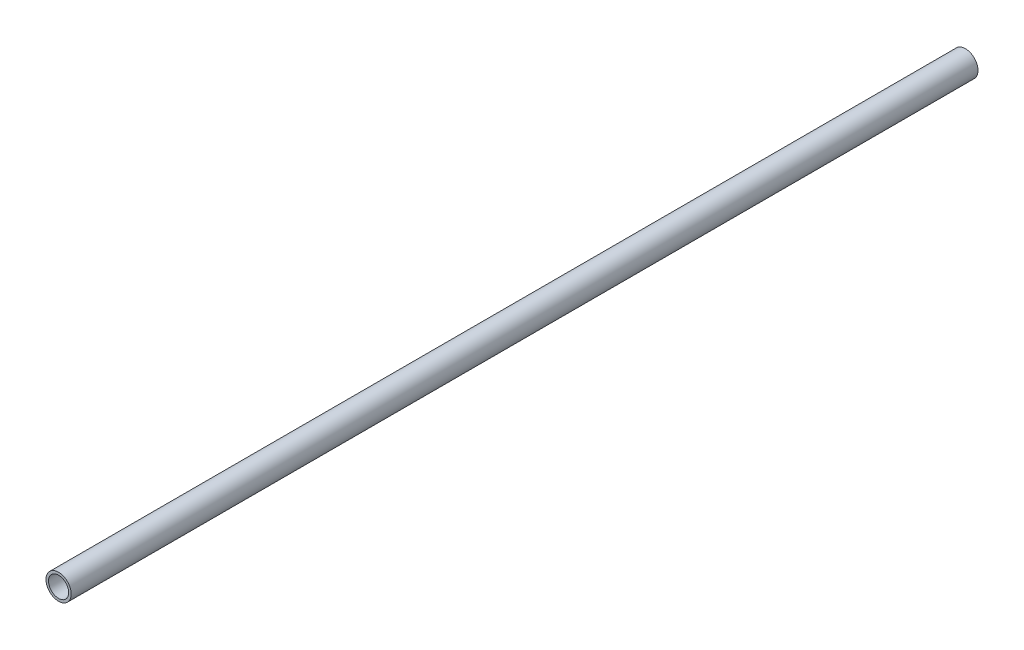
from build123d import *

# Parameters (mm, degrees)
SKETCH1_R           = 3.175
SKETCH1_R_2         = 2.54
BOSS_EXTRUDE1_DEPTH = 228.6


with BuildPart() as part:
    # Sketch1 → Boss-Extrude1 (new body)
    with BuildSketch(Plane.XY):
        Circle(SKETCH1_R)
        Circle(SKETCH1_R_2, mode=Mode.SUBTRACT)
    extrude(amount=BOSS_EXTRUDE1_DEPTH)


solid = part.part
